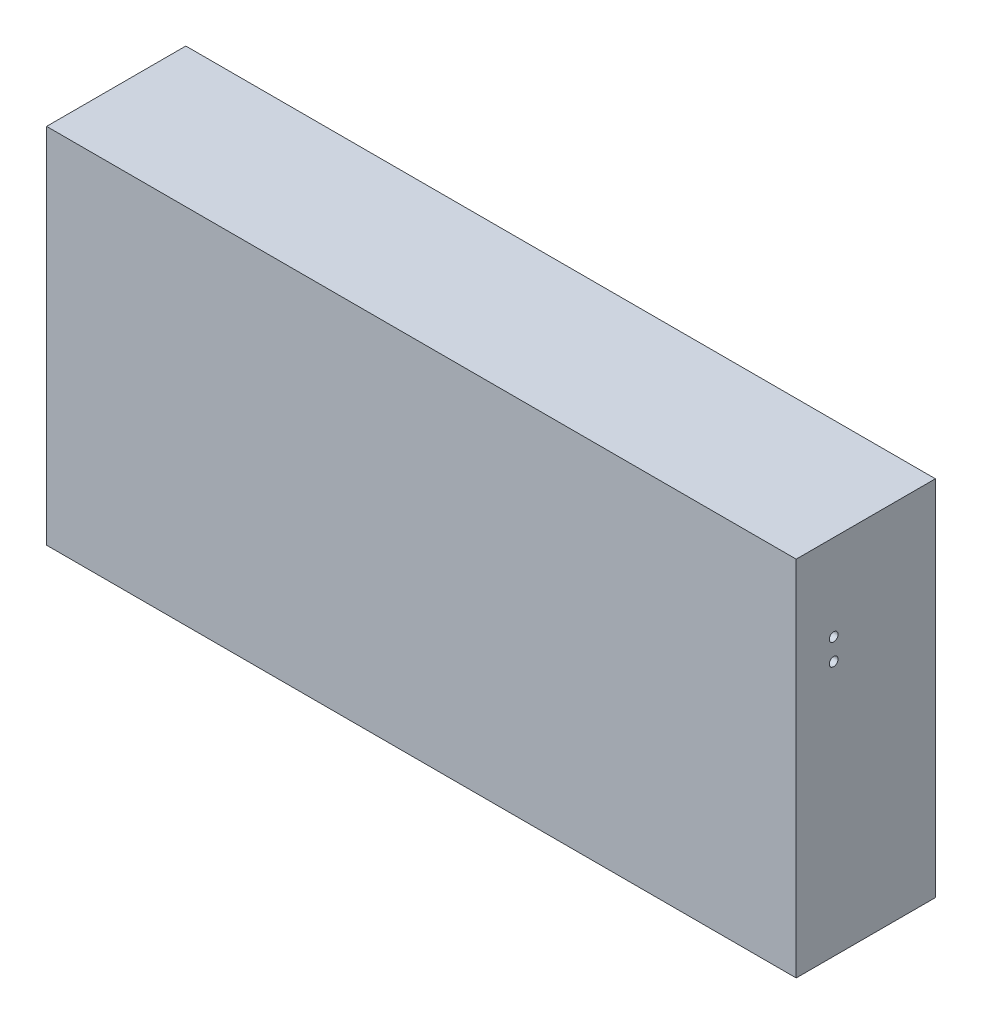
from build123d import *

# Parameters (mm, degrees)
SKETCH1_W                      = 280
SKETCH1_H                      = 52
TAPA_FRONTAL_DEPTH             = 3
VENAS_APOYO_DEPTH              = 129
SKETCH3_W                      = 280
SKETCH3_H                      = 52
PLACA_UNI_N_DEPTH              = 3.5
CUT_EXTRUDE4_REACH             = 208.851
CUT_EXTRUDE5_DEPTH             = 316.507527644
F_4_3_4_3_DIAMETER_HOLE1_D     = 4.3
F_4_3_4_3_DIAMETER_HOLE1_DEPTH = 3.5
F_2_5_3_DIAMETER_HOLE1_D       = 3
F_2_5_3_DIAMETER_HOLE1_DEPTH   = 10
SKETCH17_R                     = 3
SKETCH17_R_2                   = 1.5
BOSS_EXTRUDE1_DEPTH            = 5
FILLET1_R                      = 3
SKETCH18_R                     = 1.65
CUT_EXTRUDE6_DEPTH             = 319.064458876


with BuildPart() as part:
    # Sketch1 → Tapa frontal (new body)
    with BuildSketch(Plane.XZ.offset(-135)):
        with Locations((140, 35)):
            Rectangle(SKETCH1_W, SKETCH1_H)
    extrude(amount=-TAPA_FRONTAL_DEPTH)

    # Sketch2 → Venas apoyo (add)
    with BuildSketch(Plane.XZ.offset(-135)):
        Polygon((271.25, 9), (271.25, 17), (277, 22.75), (277, 58), (141.5, 58), (141.5, 24.25), (148.75, 17), (148.75, 9), (131.25, 9), (131.25, 17), (138.5, 24.25), (138.5, 58), (3, 58), (3, 22.75), (8.75, 17), (8.75, 9), (0, 9), (0, 61), (280, 61), (280, 9), align=None)
    extrude(amount=VENAS_APOYO_DEPTH)

    # Sketch3 → Placa unión (add)
    with BuildSketch(Plane.XZ.offset(-6)):
        with Locations((140, 35)):
            Rectangle(SKETCH3_W, SKETCH3_H)
    extrude(amount=PLACA_UNI_N_DEPTH)

    # Sketch9 → Cut-Extrude4 (cut, up to next)
    with BuildSketch(Plane.ZY.offset(-138.5), mode=Mode.PRIVATE) as cut_extrude4_sk1:
        with BuildLine():
            Line((55, 62), (55, 76))
            ThreePointArc((55, 76), (42, 89), (29, 76))
            Line((29, 76), (29, 62))
            ThreePointArc((29, 62), (42, 49), (55, 62))
        make_face()
    cut_extrude4_tool1 = extrude(cut_extrude4_sk1.sketch, amount=-CUT_EXTRUDE4_REACH, mode=Mode.PRIVATE) & part.part
    add(cut_extrude4_tool1.solids().sort_by_distance((138.5, 69, 42))[0], mode=Mode.SUBTRACT)

    # Sketch10 → Cut-Extrude5 (cut, through all)
    with BuildSketch(Plane(origin=(0, 6, 0), x_dir=(-1, 0, 0), z_dir=(0, 1, 0))):
        with BuildLine():
            Line((-81, 21), (-59, 21))
            ThreePointArc((-59, 21), (-48, 32), (-59, 43))
            Line((-59, 43), (-81, 43))
            ThreePointArc((-81, 43), (-92, 32), (-81, 21))
        make_face()
        with BuildLine():
            Line((-199, 43), (-221, 43))
            ThreePointArc((-221, 43), (-232, 32), (-221, 21))
            Line((-221, 21), (-199, 21))
            ThreePointArc((-199, 21), (-188, 32), (-199, 43))
        make_face()
    extrude(amount=-CUT_EXTRUDE5_DEPTH, mode=Mode.SUBTRACT)

    # Ø4.3 (4.3) Diameter Hole1
    with Locations(Plane(origin=(0, 6, 0), x_dir=(1, 0, 0), z_dir=(0, 1, 0))):
        with Locations((245, -46), (175, -46), (245, -20), (175, -20), (105, -46), (35, -46), (105, -20), (35, -20)):
            Hole(F_4_3_4_3_DIAMETER_HOLE1_D / 2, depth=F_4_3_4_3_DIAMETER_HOLE1_DEPTH)

    # Ø2.5 (3) Diameter Hole1
    with Locations(Plane(origin=(0, 0, 9), x_dir=(-1, 0, 0), z_dir=(0, 0, -1))):
        with Locations((-275.5, 126), (-144.5, 126), (-275.5, 104), (-275.5, 82), (-144.5, 104), (-144.5, 82), (-135.5, 126), (-4.5, 126), (-135.5, 104), (-135.5, 82), (-4.5, 104), (-4.5, 82), (-275.5, 60), (-144.5, 60), (-275.5, 38), (-275.5, 16), (-144.5, 38), (-144.5, 16), (-135.5, 60), (-4.5, 60), (-135.5, 38), (-135.5, 16), (-4.5, 38), (-4.5, 16)):
            Hole(F_2_5_3_DIAMETER_HOLE1_D / 2, depth=F_2_5_3_DIAMETER_HOLE1_DEPTH)

    # Sketch17 → Boss-Extrude1 (add)
    # profile 1 of 8: a face of its own
    with BuildSketch(Plane(origin=(0, 0, 58), x_dir=(-1, 0, 0), z_dir=(0, 0, -1))):
        with Locations(Location((-238.922258381, 87.46, 0), (0, 0, 180))):
            Circle(SKETCH17_R)
        with Locations((-238.922258381, 87.46)):
            Circle(SKETCH17_R_2, mode=Mode.SUBTRACT)
    # profile 2 of 8: a face of its own
    with BuildSketch(Plane(origin=(0, 0, 58), x_dir=(-1, 0, 0), z_dir=(0, 0, -1))):
        with Locations(Location((-238.922258381, 51.154, 0), (0, 0, 180))):
            Circle(SKETCH17_R)
        with Locations((-238.922258381, 51.154)):
            Circle(SKETCH17_R_2, mode=Mode.SUBTRACT)
    # profile 3 of 8: a face of its own
    with BuildSketch(Plane(origin=(0, 0, 58), x_dir=(-1, 0, 0), z_dir=(0, 0, -1))):
        with Locations(Location((-184.693258381, 51.154, 0), (0, 0, 180))):
            Circle(SKETCH17_R)
        with Locations((-184.693258381, 51.154)):
            Circle(SKETCH17_R_2, mode=Mode.SUBTRACT)
    # profile 4 of 8: a face of its own
    with BuildSketch(Plane(origin=(0, 0, 58), x_dir=(-1, 0, 0), z_dir=(0, 0, -1))):
        with Locations(Location((-184.693258381, 87.46, 0), (0, 0, 180))):
            Circle(SKETCH17_R)
        with Locations((-184.693258381, 87.46)):
            Circle(SKETCH17_R_2, mode=Mode.SUBTRACT)
    # profile 5 of 8: a face of its own
    with BuildSketch(Plane(origin=(0, 0, 58), x_dir=(-1, 0, 0), z_dir=(0, 0, -1))):
        with Locations(Location((-96.537437962, 87.46, 0), (0, 0, 180))):
            Circle(SKETCH17_R)
        with Locations((-96.537437962, 87.46)):
            Circle(SKETCH17_R_2, mode=Mode.SUBTRACT)
    # profile 6 of 8: a face of its own
    with BuildSketch(Plane(origin=(0, 0, 58), x_dir=(-1, 0, 0), z_dir=(0, 0, -1))):
        with Locations(Location((-42.308437962, 87.46, 0), (0, 0, 180))):
            Circle(SKETCH17_R)
        with Locations((-42.308437962, 87.46)):
            Circle(SKETCH17_R_2, mode=Mode.SUBTRACT)
    # profile 7 of 8: a face of its own
    with BuildSketch(Plane(origin=(0, 0, 58), x_dir=(-1, 0, 0), z_dir=(0, 0, -1))):
        with Locations(Location((-42.308437962, 51.154, 0), (0, 0, 180))):
            Circle(SKETCH17_R)
        with Locations((-42.308437962, 51.154)):
            Circle(SKETCH17_R_2, mode=Mode.SUBTRACT)
    # profile 8 of 8: a face of its own
    with BuildSketch(Plane(origin=(0, 0, 58), x_dir=(-1, 0, 0), z_dir=(0, 0, -1))):
        with Locations(Location((-96.537437962, 51.154, 0), (0, 0, 180))):
            Circle(SKETCH17_R)
        with Locations((-96.537437962, 51.154)):
            Circle(SKETCH17_R_2, mode=Mode.SUBTRACT)
    extrude(amount=BOSS_EXTRUDE1_DEPTH)

    # Fillet1
    fillet1_edges = [part.edges().sort_by_distance(p)[0] for p in [
        (235.922258381, 87.46, 58),
        (181.693258381, 87.46, 58),
        (181.693258381, 51.154, 58),
        (235.922258381, 51.154, 58),
        (93.537437962, 51.154, 58),
        (39.308437962, 51.154, 58),
        (39.308437962, 87.46, 58),
        (93.537437962, 87.46, 58),
    ]]
    fillet(fillet1_edges, radius=FILLET1_R)

    # Sketch18 → Cut-Extrude6 (cut, through all)
    with BuildSketch(Plane.ZY):
        with Locations((47, 105.856776801)):
            Circle(SKETCH18_R)
        with Locations((47, 97.856776801)):
            Circle(SKETCH18_R)
    extrude(amount=-CUT_EXTRUDE6_DEPTH, mode=Mode.SUBTRACT)


solid = part.part
